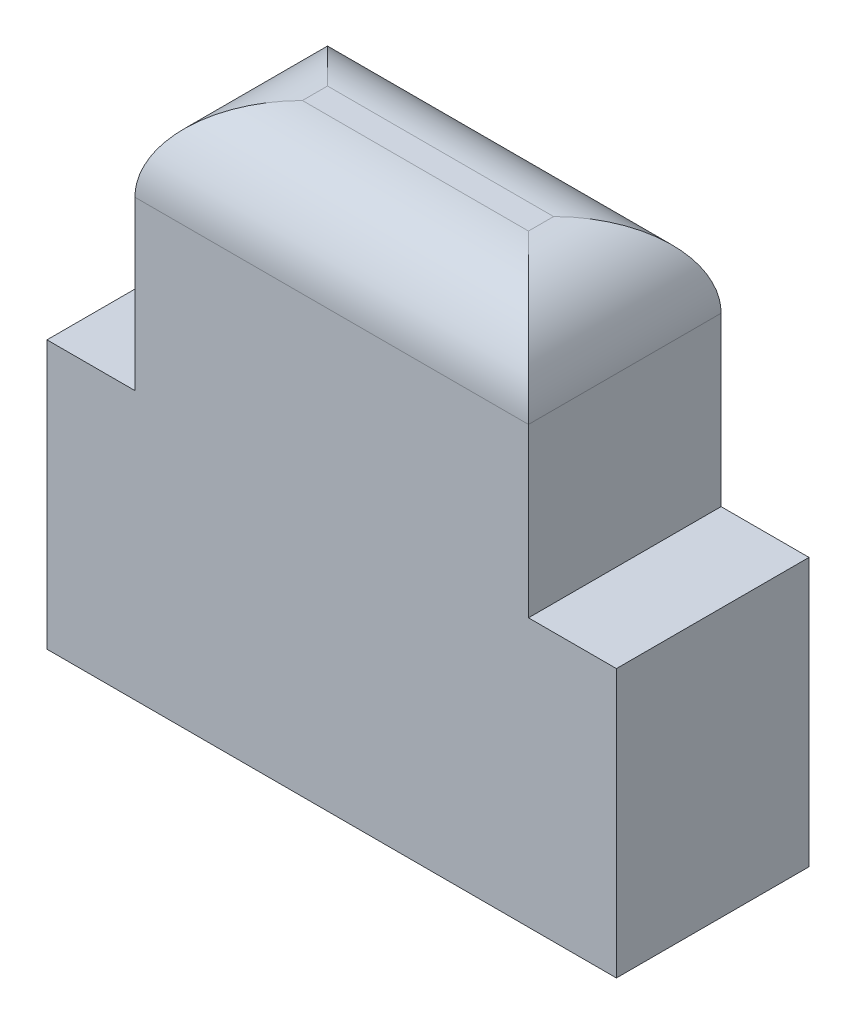
from build123d import *

# Parameters (mm, degrees)
SKETCH1_W           = 6.8
SKETCH1_H           = 2.3
BOSS_EXTRUDE1_DEPTH = 3.2
SKETCH2_W           = 4.7
SKETCH2_H           = 2.3
BOSS_EXTRUDE2_DEPTH = 3
FILLET1_R           = 1


with BuildPart() as part:
    # Sketch1 → Boss-Extrude1 (new body)
    with BuildSketch(Plane(origin=(0, 0, 0), x_dir=(1, 0, 0), z_dir=(0, 1, 0))):
        Rectangle(SKETCH1_W, SKETCH1_H)
    extrude(amount=BOSS_EXTRUDE1_DEPTH)

    # Sketch2 → Boss-Extrude2 (add)
    with BuildSketch(Plane(origin=(0, 3.2, 0), x_dir=(1, 0, 0), z_dir=(0, 1, 0))):
        Rectangle(SKETCH2_W, SKETCH2_H)
    extrude(amount=BOSS_EXTRUDE2_DEPTH)

    # Fillet1
    fillet1_edges = [part.edges().sort_by_distance(p)[0] for p in [
        (2.35, 6.2, 0),
        (0, 6.2, -1.15),
        (-2.35, 6.2, 0),
        (0, 6.2, 1.15),
    ]]
    fillet(fillet1_edges, radius=FILLET1_R)


solid = part.part
